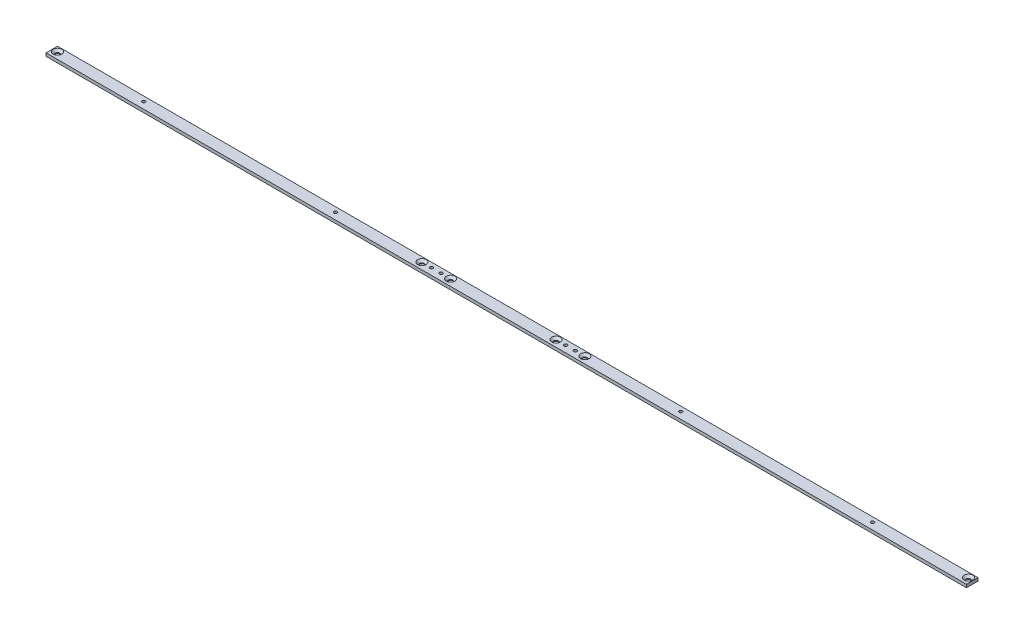
from build123d import *

# Parameters (mm, degrees)
SKETCH1_W                    = 960
SKETCH1_H                    = 12
BOSS_EXTRUDE1_DEPTH          = 3.175
CSK_FOR_M4_SFHCS1_AT_2_COUNT = 2
CSK_FOR_M4_SFHCS1_AT_2_PITCH = 570
CSK_FOR_M4_SFHCS1_AT_3_COUNT = 2
CSK_FOR_M4_SFHCS1_AT_3_PITCH = 540
CSK_FOR_M4_SFHCS1_AT_4_COUNT = 2
CSK_FOR_M4_SFHCS1_AT_4_PITCH = 430
CSK_FOR_M4_SFHCS1_AT_5_COUNT = 2
CSK_FOR_M4_SFHCS1_AT_5_PITCH = 400
CSK_FOR_M4_SFHCS1_AT_6_COUNT = 2
CSK_FOR_M4_SFHCS1_AT_6_PITCH = 950
M4X0_7_TAPPED_HOLE2_D        = 3.3


with BuildPart() as part:
    # Sketch1 → Boss-Extrude1 (new body)
    with BuildSketch(Plane(origin=(0, 0, 0), x_dir=(1, 0, 0), z_dir=(0, 1, 0))):
        Rectangle(SKETCH1_W, SKETCH1_H)
    extrude(amount=BOSS_EXTRUDE1_DEPTH)

    # Sketch3 → CSK for M4 SFHCS1 (revolve, cut)
    with BuildSketch(Plane(origin=(475, 3.175, -1), x_dir=(0, 0, 1), z_dir=(1, 0, 0))):
        Polygon((0, 0), (0, 3.175), (2.25, 3.175), (2.25, 2.23), (4.48, 0), align=None)
    csk_for_m4_sfhcs1 = revolve(axis=Axis((475, 9.525, -1), (0, -1, 0)), mode=Mode.SUBTRACT)

    # CSK for M4 SFHCS1 at 2: CSK for M4 SFHCS1 ×2
    with Locations(*[(-i * CSK_FOR_M4_SFHCS1_AT_2_PITCH, 0, 0) for i in range(1, CSK_FOR_M4_SFHCS1_AT_2_COUNT)]):
        add(csk_for_m4_sfhcs1, mode=Mode.SUBTRACT)

    # CSK for M4 SFHCS1 at 3: CSK for M4 SFHCS1 ×2
    with Locations(*[(-i * CSK_FOR_M4_SFHCS1_AT_3_PITCH, 0, 0) for i in range(1, CSK_FOR_M4_SFHCS1_AT_3_COUNT)]):
        add(csk_for_m4_sfhcs1, mode=Mode.SUBTRACT)

    # CSK for M4 SFHCS1 at 4: CSK for M4 SFHCS1 ×2
    with Locations(*[(-i * CSK_FOR_M4_SFHCS1_AT_4_PITCH, 0, 0) for i in range(1, CSK_FOR_M4_SFHCS1_AT_4_COUNT)]):
        add(csk_for_m4_sfhcs1, mode=Mode.SUBTRACT)

    # CSK for M4 SFHCS1 at 5: CSK for M4 SFHCS1 ×2
    with Locations(*[(-i * CSK_FOR_M4_SFHCS1_AT_5_PITCH, 0, 0) for i in range(1, CSK_FOR_M4_SFHCS1_AT_5_COUNT)]):
        add(csk_for_m4_sfhcs1, mode=Mode.SUBTRACT)

    # CSK for M4 SFHCS1 at 6: CSK for M4 SFHCS1 ×2
    with Locations(*[(-i * CSK_FOR_M4_SFHCS1_AT_6_PITCH, 0, 0) for i in range(1, CSK_FOR_M4_SFHCS1_AT_6_COUNT)]):
        add(csk_for_m4_sfhcs1, mode=Mode.SUBTRACT)

    # M4x0.7 Tapped Hole2 (through all)
    with Locations(Plane(origin=(0, 3.175, 0), x_dir=(1, 0, 0), z_dir=(0, 1, 0))):
        with Locations((-85, 1), (-75, 1), (55, 1), (65, 1), (175, 1), (375, 1), (-385, 1), (-185, 1)):
            Hole(M4X0_7_TAPPED_HOLE2_D / 2)


solid = part.part
